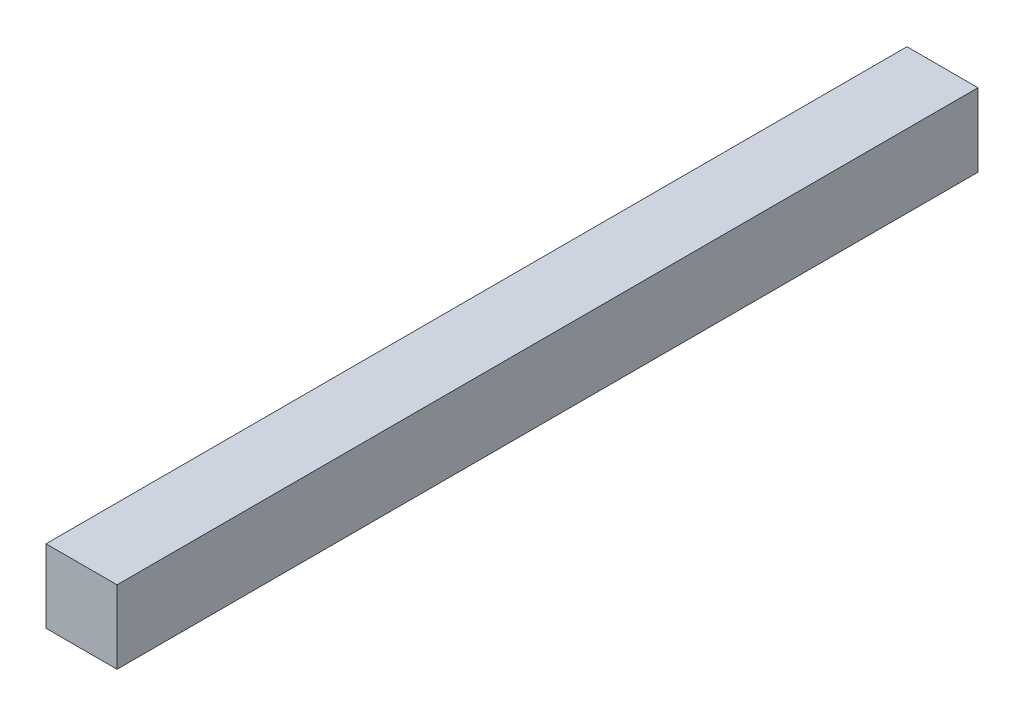
from build123d import *

# Parameters (mm, degrees)
SKETCH1_W           = 25.146
SKETCH1_H           = 25.908
BOSS_EXTRUDE1_DEPTH = 304.8


with BuildPart() as part:
    # Sketch1 → Boss-Extrude1 (new body)
    with BuildSketch(Plane.XY):
        with Locations((12.573, 12.954)):
            Rectangle(SKETCH1_W, SKETCH1_H)
    extrude(amount=BOSS_EXTRUDE1_DEPTH)


solid = part.part
